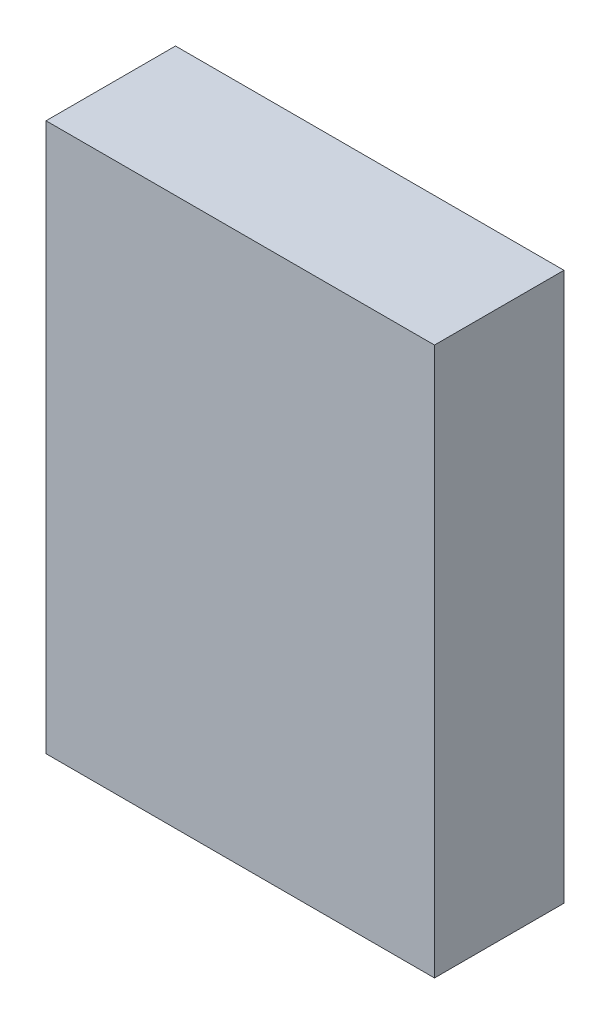
from build123d import *

# Parameters (mm, degrees)
SKETCH1_W           = 9
SKETCH1_H           = 12.7
BOSS_EXTRUDE1_DEPTH = 3


with BuildPart() as part:
    # Sketch1 → Boss-Extrude1 (new body)
    with BuildSketch(Plane.XY):
        with Locations((4.5, 6.35)):
            Rectangle(SKETCH1_W, SKETCH1_H)
    extrude(amount=BOSS_EXTRUDE1_DEPTH)


solid = part.part
